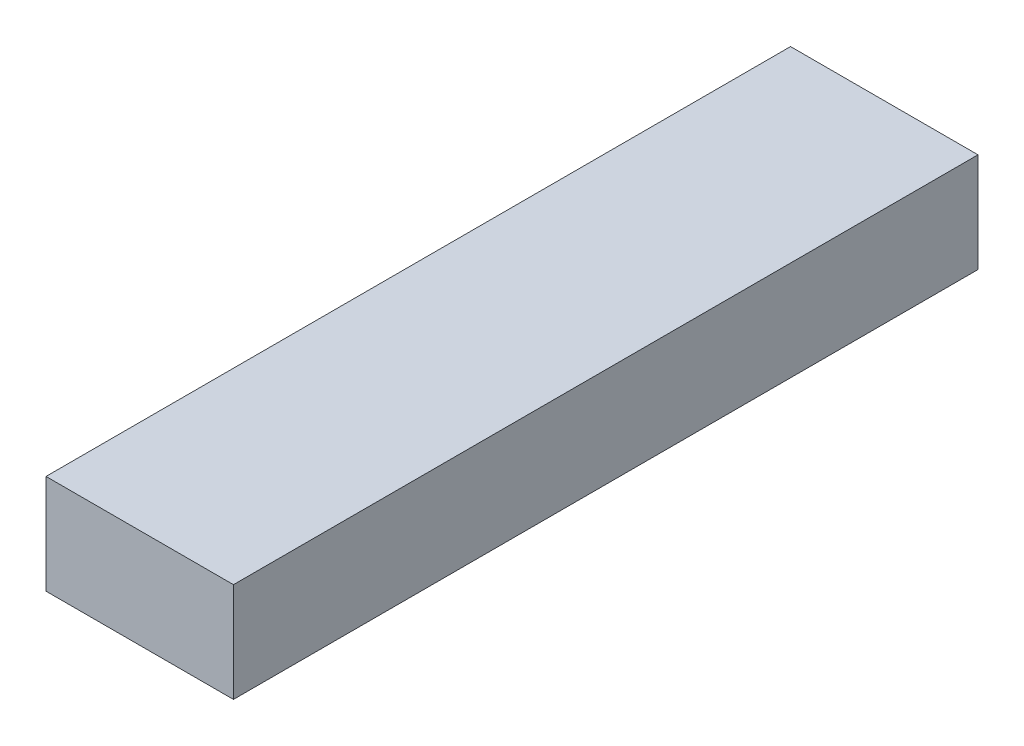
from build123d import *

# Parameters (mm, degrees)
SKETCH1_W           = 88.125442178
SKETCH1_H           = 46.72967526
BOSS_EXTRUDE1_DEPTH = 350


with BuildPart() as part:
    # Sketch1 → Boss-Extrude1 (new body)
    with BuildSketch(Plane.XY):
        with Locations((44.062721089, 23.36483763)):
            Rectangle(SKETCH1_W, SKETCH1_H)
    extrude(amount=BOSS_EXTRUDE1_DEPTH)


solid = part.part
